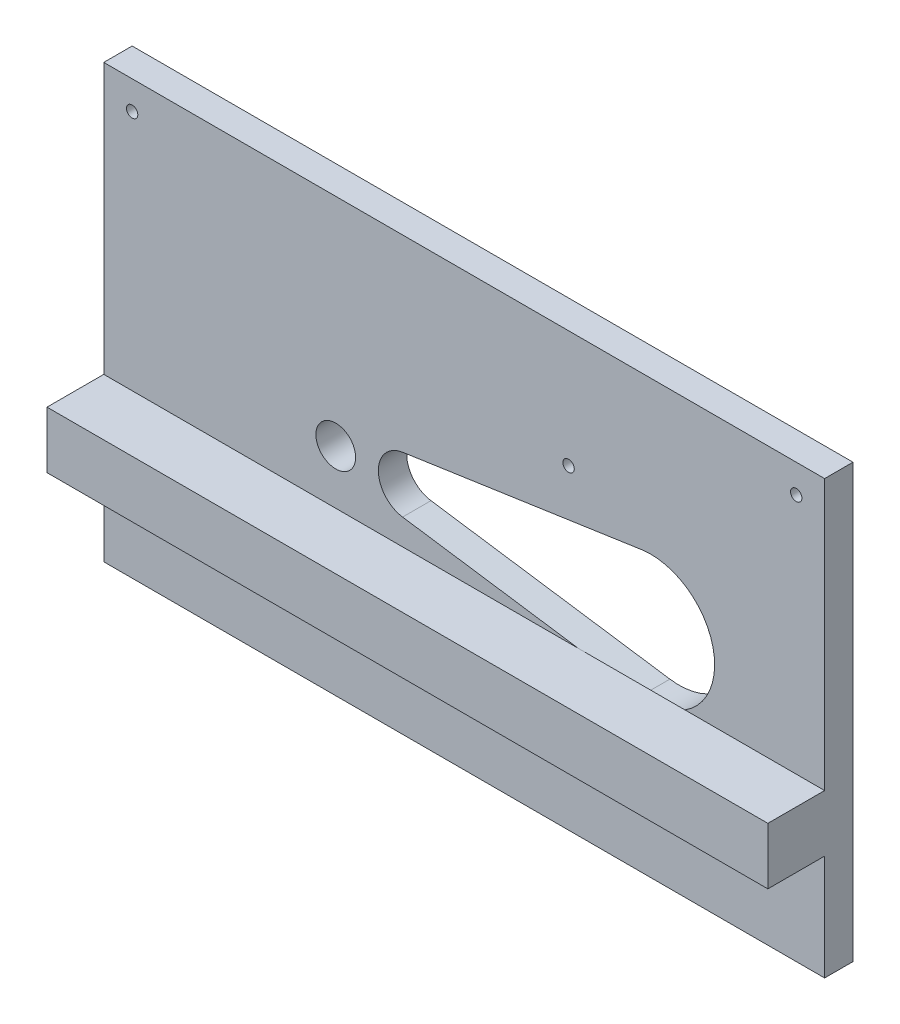
from build123d import *

# Parameters (mm, degrees)
CROQUIS1_W              = 254
CROQUIS1_H              = 152.4
CROQUIS1_R              = 2
CROQUIS1_R_2            = 7
SALIENTE_EXTRUIR1_DEPTH = 10
CROQUIS2_R              = 2
CORTAR_EXTRUIR1_DEPTH   = 10
CROQUIS3_W              = 254
CROQUIS3_H              = 20
SALIENTE_EXTRUIR2_DEPTH = 20


with BuildPart() as part:
    # Croquis1 → Saliente-Extruir1 (new body)
    with BuildSketch(Plane.XY):
        with Locations((1.935502346, -46)):
            Rectangle(CROQUIS1_W, CROQUIS1_H)
        with Locations((38.725502346, -81)):
            Circle(CROQUIS1_R, mode=Mode.SUBTRACT)
        with Locations((-43.314497654, -46)):
            Circle(CROQUIS1_R_2, mode=Mode.SUBTRACT)
        with BuildLine():
            Line((-19.767986026, -36.106195294), (64.415153509, -23.738939412))
            ThreePointArc((64.415153509, -23.738939412), (82.393784897, -28.973067674), (90.185502346, -46))
            ThreePointArc((90.185502346, -46), (82.393784897, -63.026932326), (64.415153509, -68.261060588))
            Line((64.415153509, -68.261060588), (-19.767986026, -55.893804706))
            ThreePointArc((-19.767986026, -55.893804706), (-28.314497654, -46), (-19.767986026, -36.106195294))
        make_face(mode=Mode.SUBTRACT)
        with Locations((38.725502346, -11)):
            Circle(CROQUIS1_R, mode=Mode.SUBTRACT)
    extrude(amount=SALIENTE_EXTRUIR1_DEPTH)

    # Croquis2 → Cortar-Extruir1 (cut)
    with BuildSketch(Plane.XY.offset(10)):
        with Locations((-115.064497654, 20.2)):
            Circle(CROQUIS2_R)
        with Locations(Location((118.935502346, 20.2, 0), (0, 0, 180))):
            Circle(CROQUIS2_R)
    extrude(amount=-CORTAR_EXTRUIR1_DEPTH, mode=Mode.SUBTRACT)

    # Croquis3 → Saliente-Extruir2 (add)
    with BuildSketch(Plane.XY.offset(10)):
        with Locations((1.935502346, -75)):
            Rectangle(CROQUIS3_W, CROQUIS3_H)
    extrude(amount=SALIENTE_EXTRUIR2_DEPTH)


solid = part.part
